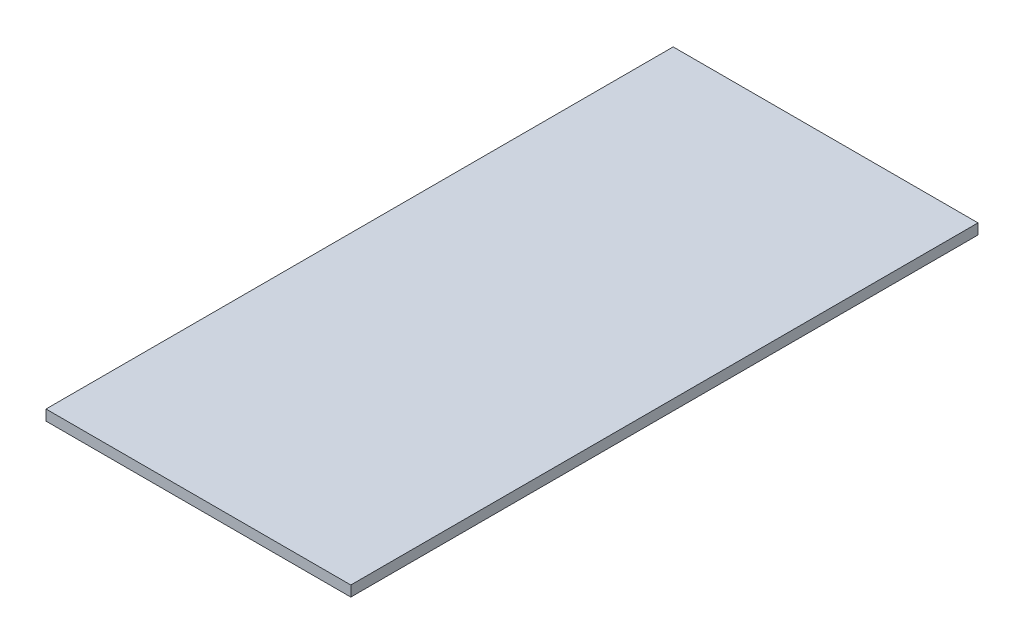
from build123d import *

# Parameters (mm, degrees)
SKETCH2_W           = 552.45
SKETCH2_H           = 1136.7389
BOSS_EXTRUDE1_DEPTH = 19.05


with BuildPart() as part:
    # Sketch2 → Boss-Extrude1 (new body)
    with BuildSketch(Plane(origin=(0, 0, 0), x_dir=(1, 0, 0), z_dir=(0, 1, 0))):
        Rectangle(SKETCH2_W, SKETCH2_H)
    extrude(amount=BOSS_EXTRUDE1_DEPTH)


solid = part.part
